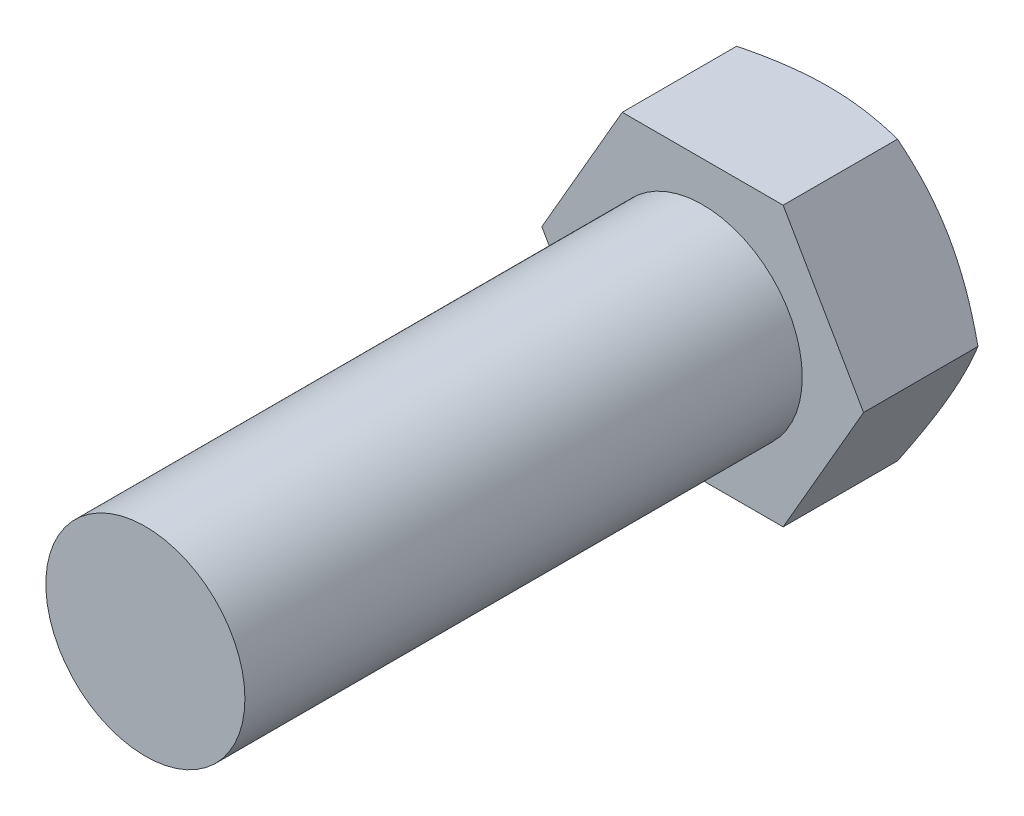
from build123d import *

# Parameters (mm, degrees)
SALIENTE_EXTRUIR1_DEPTH = 9
CROQUIS2_R              = 7.14375
SALIENTE_EXTRUIR2_DEPTH = 40
CROQUIS3_R              = 25.754458297
CROQUIS3_R_2            = 10
CORTAR_EXTRUIR1_DEPTH   = 3
CORTAR_EXTRUIR1_DRAFT   = -63


with BuildPart() as part:
    # Croquis1 → Saliente-Extruir1 (new body)
    with BuildSketch(Plane.XY):
        Polygon((11.547005384, 0), (5.773502692, 10), (-5.773502692, 10), (-11.547005384, 0), (-5.773502692, -10), (5.773502692, -10), align=None)
    extrude(amount=SALIENTE_EXTRUIR1_DEPTH)

    # Croquis2 → Saliente-Extruir2 (add)
    with BuildSketch(Plane.XY.offset(9)):
        Circle(CROQUIS2_R)
    extrude(amount=SALIENTE_EXTRUIR2_DEPTH)


with BuildPart() as cortar_extruir1_tool:
    # Croquis3 → Cortar-Extruir1 (with draft: the straight prism first)
    with BuildSketch(Plane(origin=(0, 0, 0), x_dir=(-1, 0, 0), z_dir=(0, 0, -1))):
        Circle(CROQUIS3_R)
        Circle(CROQUIS3_R_2, mode=Mode.SUBTRACT)
    extrude(amount=-CORTAR_EXTRUIR1_DEPTH)
    # Cortar-Extruir1: the draft: its side faces are tilted about the plane it starts from
    cortar_extruir1_sides = [cortar_extruir1_tool.faces().sort_by_distance(p)[0] for p in [
        (25.754458297, 0, 1.5),
        (10, 0, 1.5),
    ]]
    draft(cortar_extruir1_sides, Plane(origin=(0, 0, 0), x_dir=(-1, 0, 0), z_dir=(0, 0, -1)), CORTAR_EXTRUIR1_DRAFT)


with BuildPart() as part_1:
    add(part.part)

    # Cortar-Extruir1: cut by cortar_extruir1_tool
    add(cortar_extruir1_tool.part, mode=Mode.SUBTRACT)


solid = part_1.part
